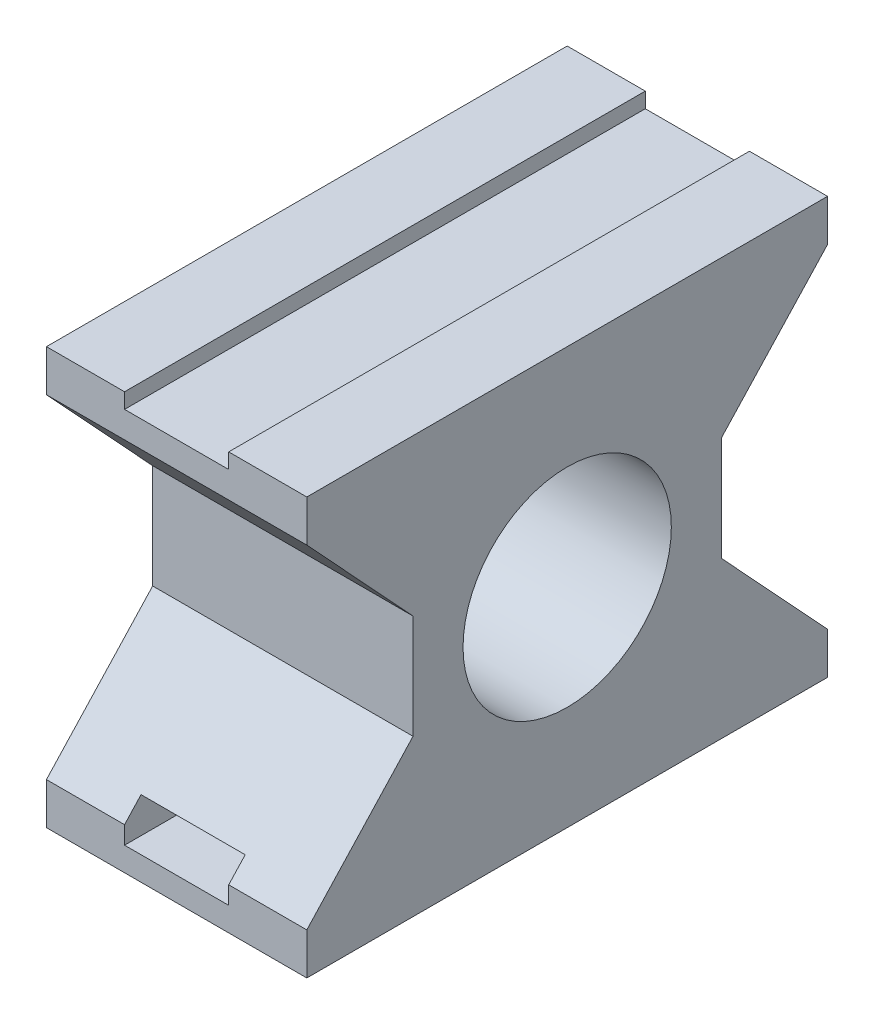
from build123d import *

# Parameters (mm, degrees)
SKETCH1_R           = 20
BOSS_EXTRUDE1_DEPTH = 50
SKETCH2_W           = 20
SKETCH2_H           = 5.867462555
SKETCH2_H_2         = 6.829602609
CUT_EXTRUDE1_DEPTH  = 119.98554368


with BuildPart() as part:
    # Sketch1 → Boss-Extrude1 (new body)
    with BuildSketch(Plane(origin=(0, 0, 0), x_dir=(0, 0, -1), z_dir=(1, 0, 0))):
        Polygon((29.524911161, 40.713137988), (-70.475088839, 40.713137988), (-70.475088839, 32.713137988), (-50.079010784, 10.713137988), (-50.079010784, -9.286862012), (-70.475088839, -31.286862012), (-70.475088839, -39.286862012), (29.524911161, -39.286862012), (29.524911161, -31.286862012), (9.128833107, -9.286862012), (9.128833107, 10.713137988), (29.524911161, 32.713137988), align=None)
        with Locations((-20.475088839, 0.713137988)):
            Circle(SKETCH1_R, mode=Mode.SUBTRACT)
    extrude(amount=BOSS_EXTRUDE1_DEPTH)

    # Sketch2 → Cut-Extrude1 (cut, through all)
    with BuildSketch(Plane.XY.offset(70.475088839)):
        with Locations((25, 40.713137989)):
            Rectangle(SKETCH2_W, SKETCH2_H)
        with Locations((25, -31.286862012)):
            Rectangle(SKETCH2_W, SKETCH2_H_2)
    extrude(amount=-CUT_EXTRUDE1_DEPTH, mode=Mode.SUBTRACT)


solid = part.part
